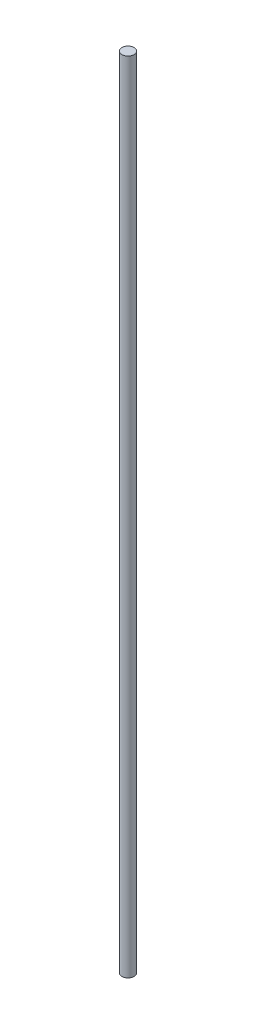
from build123d import *

# Parameters (mm, degrees)
SZKIC1_R                    = 4
DODANIE_WYCI_GNI_CIE1_DEPTH = 520


with BuildPart() as part:
    # Szkic1 → Dodanie-wyciągnięcie1 (new body)
    with BuildSketch(Plane(origin=(0, 0, 0), x_dir=(1, 0, 0), z_dir=(0, 1, 0))):
        with Locations(Location((0, 0, 0), (0, 0, 270))):
            Circle(SZKIC1_R)
    extrude(amount=DODANIE_WYCI_GNI_CIE1_DEPTH)


solid = part.part
